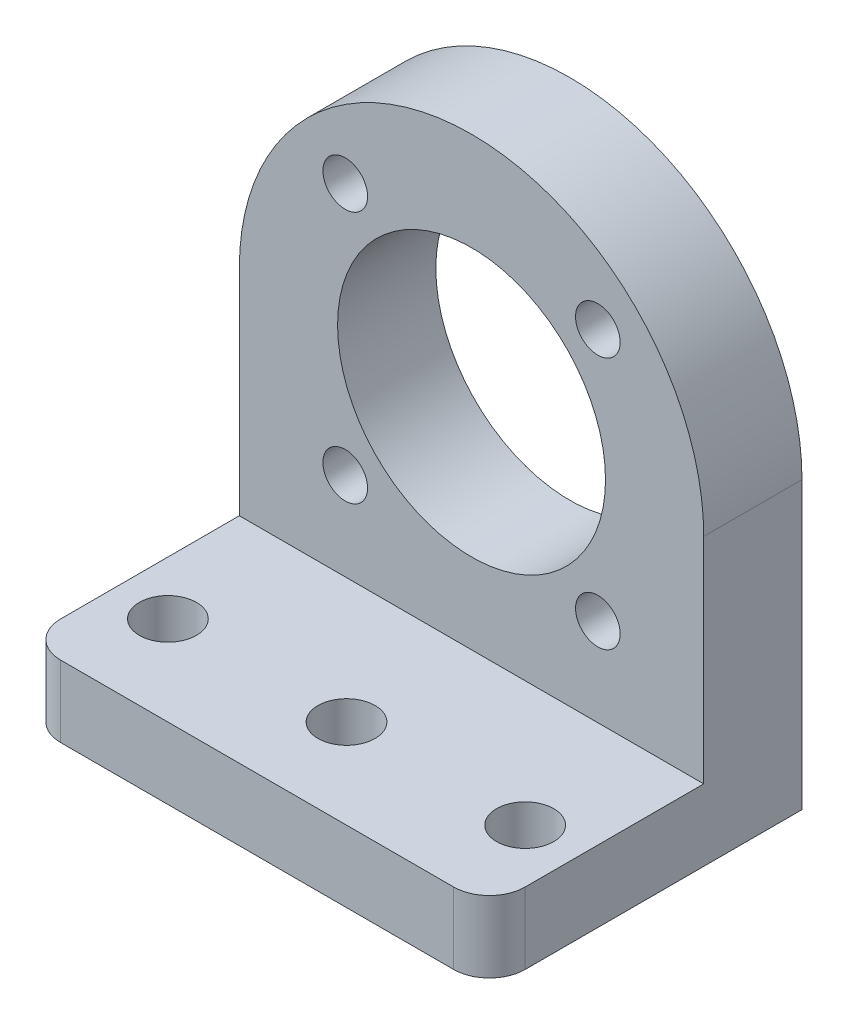
from build123d import *

# Parameters (mm, degrees)
SKETCH_1_R          = 7.5
SKETCH_1_R_2        = 1.25
EXTRUDE_1_DEPTH     = 5.5
SKETCH_2_W          = 26
SKETCH_2_H          = 4
EXTRUDE_2_DEPTH     = 12
SKETCH_3_R          = 1.6
CUT_EXTRUDE_1_DEPTH = 12
FILLET_1_R          = 2


with BuildPart() as part:
    # 草图1 → 凸台-拉伸1 (new body)
    with BuildSketch(Plane.XY):
        with BuildLine():
            Line((-13, 0), (-13, -16))
            Line((-13, -16), (13, -16))
            Line((13, -16), (13, 0))
            ThreePointArc((13, 0), (0, 13), (-13, 0))
        make_face()
        Circle(SKETCH_1_R, mode=Mode.SUBTRACT)
        with Locations((-7.071067812, 7.071067812)):
            Circle(SKETCH_1_R_2, mode=Mode.SUBTRACT)
        with Locations((7.071067812, 7.071067812)):
            Circle(SKETCH_1_R_2, mode=Mode.SUBTRACT)
        with Locations((7.071067812, -7.071067812)):
            Circle(SKETCH_1_R_2, mode=Mode.SUBTRACT)
        with Locations((-7.071067812, -7.071067812)):
            Circle(SKETCH_1_R_2, mode=Mode.SUBTRACT)
    extrude(amount=EXTRUDE_1_DEPTH)

    # 草图2 → 凸台-拉伸2 (add)
    with BuildSketch(Plane.XY.offset(5.5)):
        with Locations((0, -14)):
            Rectangle(SKETCH_2_W, SKETCH_2_H)
    extrude(amount=EXTRUDE_2_DEPTH)

    # 草图3 → 切除-拉伸1 (cut)
    with BuildSketch(Plane(origin=(0, -12, 0), x_dir=(1, 0, 0), z_dir=(0, 1, 0))):
        with Locations(Location((-10, -12.5, 0), (0, 0, 270))):
            Circle(SKETCH_3_R)
        with Locations(Location((0, -12.5, 0), (0, 0, 270))):
            Circle(SKETCH_3_R)
        with Locations(Location((10, -12.5, 0), (0, 0, 270))):
            Circle(SKETCH_3_R)
    extrude(amount=-CUT_EXTRUDE_1_DEPTH, mode=Mode.SUBTRACT)

    # 圆角1
    fillet_1_edges = [part.edges().sort_by_distance(p)[0] for p in [
        (-13, -14, 17.5),
        (13, -14, 17.5),
    ]]
    fillet(fillet_1_edges, radius=FILLET_1_R)


solid = part.part
